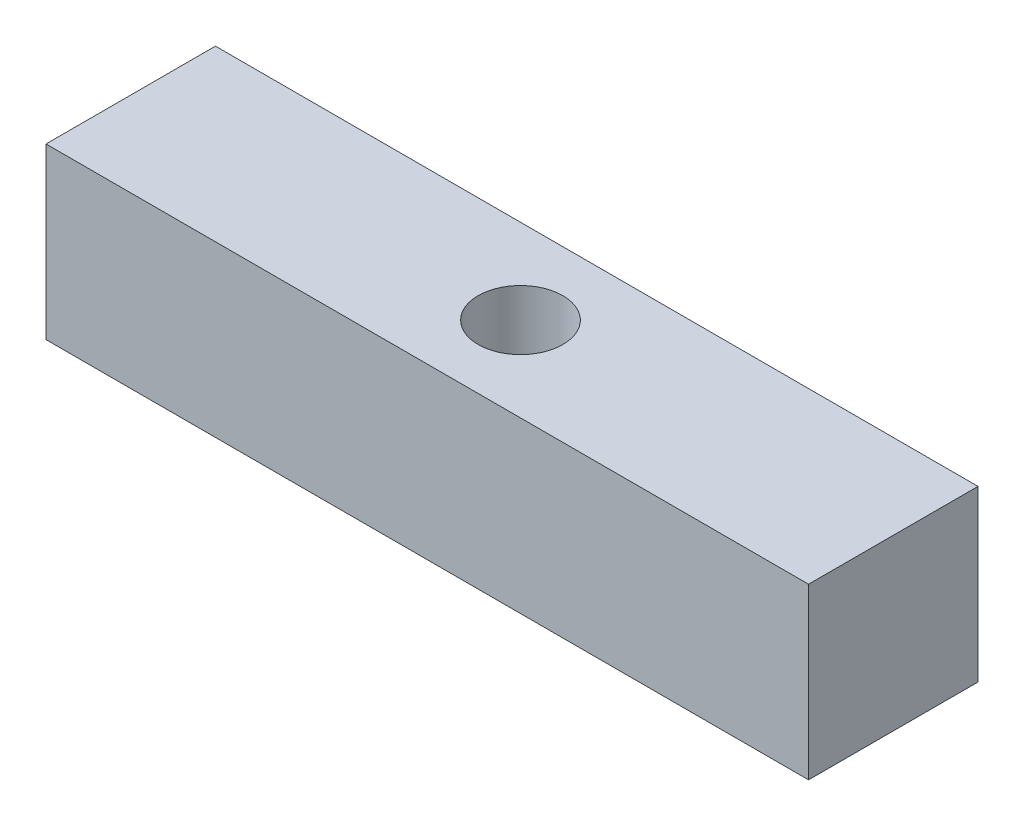
from build123d import *

# Parameters (mm, degrees)
SCHIZZO1_W                   = 45
SCHIZZO1_H                   = 10
ESTRUSIONE_ESTRUSIONE1_DEPTH = 5
SCHIZZO2_R                   = 2.5
TAGLIO_ESTRUSIONE1_DEPTH     = 26.124689053


with BuildPart() as part:
    # Schizzo1 → Estrusione-Estrusione1 (new, symmetric)
    with BuildSketch(Plane.XY):
        with Locations((0, -36.584144653)):
            Rectangle(SCHIZZO1_W, SCHIZZO1_H)
    extrude(amount=ESTRUSIONE_ESTRUSIONE1_DEPTH, both=True)

    # Schizzo2 → Taglio-Estrusione1 (cut, through all)
    with BuildSketch(Plane.XZ.offset(41.584144653)):
        with Locations(Location((0.501094215, 0, 0), (0, 0, 270))):
            Circle(SCHIZZO2_R)
    extrude(amount=-TAGLIO_ESTRUSIONE1_DEPTH, mode=Mode.SUBTRACT)


solid = part.part
